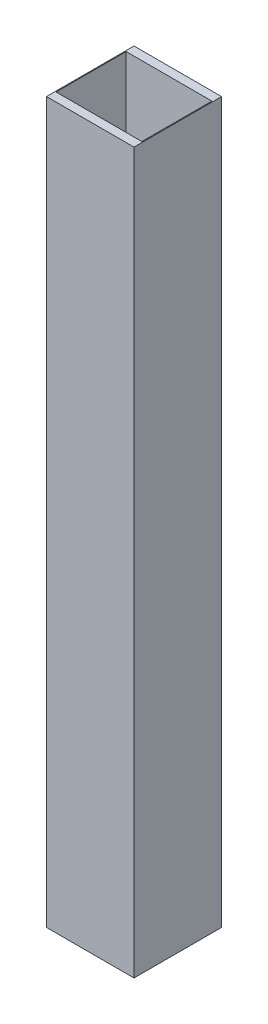
from build123d import *

# Parameters (mm, degrees)
SKETCH1_W               = 5
SKETCH1_H               = 5
SKETCH1_W_2             = 4.9
SKETCH1_H_2             = 4
BOSS_EXTRUDE1_DEPTH     = 41.1
CUT_EXTRUDE1_DEPTH      = 42.478428128
CUT_EXTRUDE1_DEPTH_BACK = 0.05
SKETCH2_W               = 2.5
SKETCH2_H               = 2.5


with BuildPart() as part:
    # Sketch1 → Boss-Extrude1 (new body)
    with BuildSketch(Plane(origin=(0, 0, 0), x_dir=(1, 0, 0), z_dir=(0, 1, 0))):
        Rectangle(SKETCH1_W, SKETCH1_H)
        Rectangle(SKETCH1_W_2, SKETCH1_H_2, mode=Mode.SUBTRACT)
    extrude(amount=BOSS_EXTRUDE1_DEPTH)

    # Sketch2 → Cut-Extrude1 (cut, two sides: drawn at the far end of the back side and taken through both)
    with BuildSketch(Plane.ZY.offset(2.5).offset(-CUT_EXTRUDE1_DEPTH_BACK)):
        with Locations((0, 2.25)):
            Rectangle(SKETCH2_W, SKETCH2_H)
    extrude(amount=CUT_EXTRUDE1_DEPTH + CUT_EXTRUDE1_DEPTH_BACK, mode=Mode.SUBTRACT)


solid = part.part
